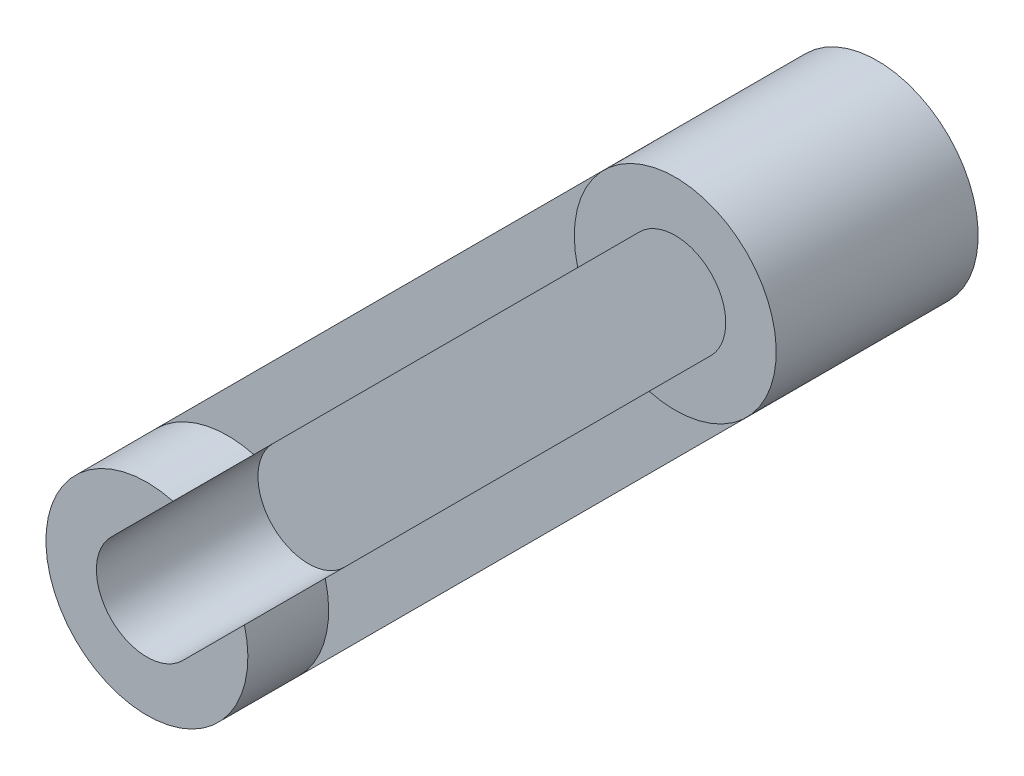
from build123d import *

# Parameters (mm, degrees)
SKETCH_1_R          = 5
SKETCH_1_R_2        = 2.5
EXTRUDE_1_DEPTH     = 10
EXTRUDE_1_2_DEPTH   = 10
EXTRUDE_2_DEPTH     = 6
CUT_EXTRUDE_1_DEPTH = 4
SKETCH_5_R          = 2.5
EXTRUDE_3_DEPTH     = 2
CUT_EXTRUDE_2_DEPTH = 4


with BuildPart() as part:
    # Эскиз1 → Бобышка-Вытянуть1 (new body)
    with BuildSketch(Plane.XY):
        with Locations((-11.277859903, 1.201925786)):
            Circle(SKETCH_1_R)
        with Locations((-11.277859903, 1.201925786)):
            Circle(SKETCH_1_R_2, mode=Mode.SUBTRACT)
    extrude(amount=EXTRUDE_1_DEPTH)



with BuildPart() as body_2:
    # Эскиз1 → Extrude 1 2 (new body)
    with BuildSketch(Plane.XY):
        with Locations((-37.440810807, -24.961025118)):
            Circle(SKETCH_1_R)
        with Locations((-37.440810807, -24.961025118)):
            Circle(SKETCH_1_R_2, mode=Mode.SUBTRACT)
    extrude(amount=EXTRUDE_1_2_DEPTH)


with BuildPart() as part_1:
    add(part.part)

    add(body_2.part)  # Бобышка-Вытянуть2 merges body 2
    # Эскиз3 → Бобышка-Вытянуть2 (add)
    with BuildSketch(Plane(origin=(0, 0, 0), x_dir=(-1, 0, 0), z_dir=(0, 0, -1))):
        Polygon((11.277859903, 1.201925786), (14.813393809, 4.737459692), (40.976344713, -21.425491212), (33.905276901, -28.496559024), (7.742325997, -2.33360812), align=None)
    extrude(amount=-EXTRUDE_2_DEPTH)

    # Эскиз4 → Вырез-Вытянуть1 (cut)
    with BuildSketch(Plane.XY.offset(6)):
        Polygon((-13.045626856, 2.969692739), (-9.51009295, -0.565841167), (-35.673043854, -26.728792071), (-39.20857776, -23.193258165), align=None)
    extrude(amount=-CUT_EXTRUDE_1_DEPTH, mode=Mode.SUBTRACT)

    # Эскиз5 → Бобышка-Вытянуть3 (add)
    with BuildSketch(Plane(origin=(0, 0, 0), x_dir=(-1, 0, 0), z_dir=(0, 0, -1))):
        with Locations((11.277859903, 1.201925786)):
            Circle(SKETCH_5_R)
        with Locations((37.440810807, -24.961025118)):
            Circle(SKETCH_5_R)
    extrude(amount=-EXTRUDE_3_DEPTH)

    # Эскиз4<2> → Вырез-Вытянуть2 (cut)
    with BuildSketch(Plane.XY.offset(6)):
        Polygon((-13.045626856, 2.969692739), (-9.51009295, -0.565841167), (-35.673043854, -26.728792071), (-39.20857776, -23.193258165), align=None)
    extrude(amount=CUT_EXTRUDE_2_DEPTH, mode=Mode.SUBTRACT)


solid = part_1.part
